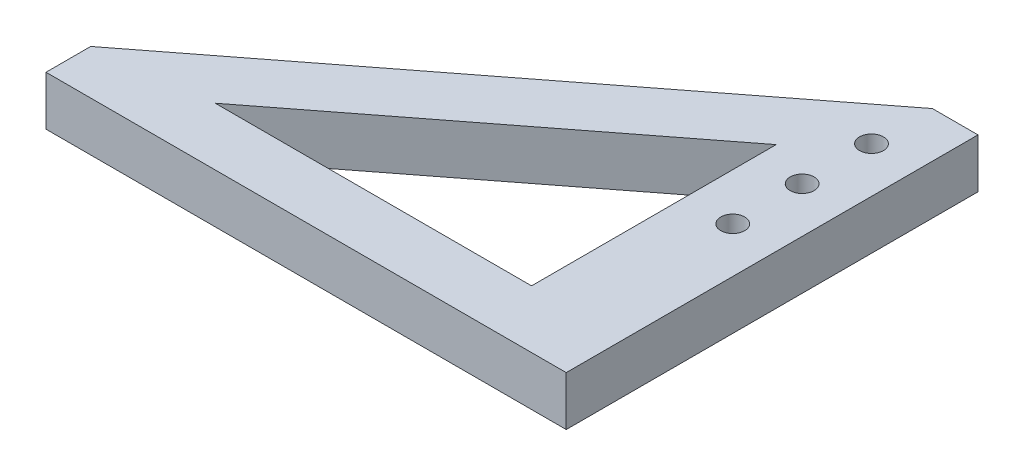
from build123d import *

# Parameters (mm, degrees)
SKETCH1_R           = 0.3937
BOSS_EXTRUDE1_DEPTH = 1.6256


with BuildPart() as part:
    # Sketch1 → Boss-Extrude1 (new body)
    with BuildSketch(Plane(origin=(0, 0, 0), x_dir=(1, 0, 0), z_dir=(0, 1, 0))):
        Polygon((1.905, 1.4732), (17.54785055, 13.570337759), (19.05, 13.570337759), (19.05, 0), (1.905, 0), align=None)
        with Locations(Location((17.54785055, 11.562216741, 0), (0, 0, 270))):
            Circle(SKETCH1_R, mode=Mode.SUBTRACT)
        with Locations(Location((17.54785055, 9.276216741, 0), (0, 0, 270))):
            Circle(SKETCH1_R, mode=Mode.SUBTRACT)
        with Locations(Location((17.54785055, 6.990216741, 0), (0, 0, 270))):
            Circle(SKETCH1_R, mode=Mode.SUBTRACT)
        Polygon((5.577391241, 1.905), (16.002, 1.905), (16.002, 9.96669744), align=None, mode=Mode.SUBTRACT)
    extrude(amount=BOSS_EXTRUDE1_DEPTH)


solid = part.part
